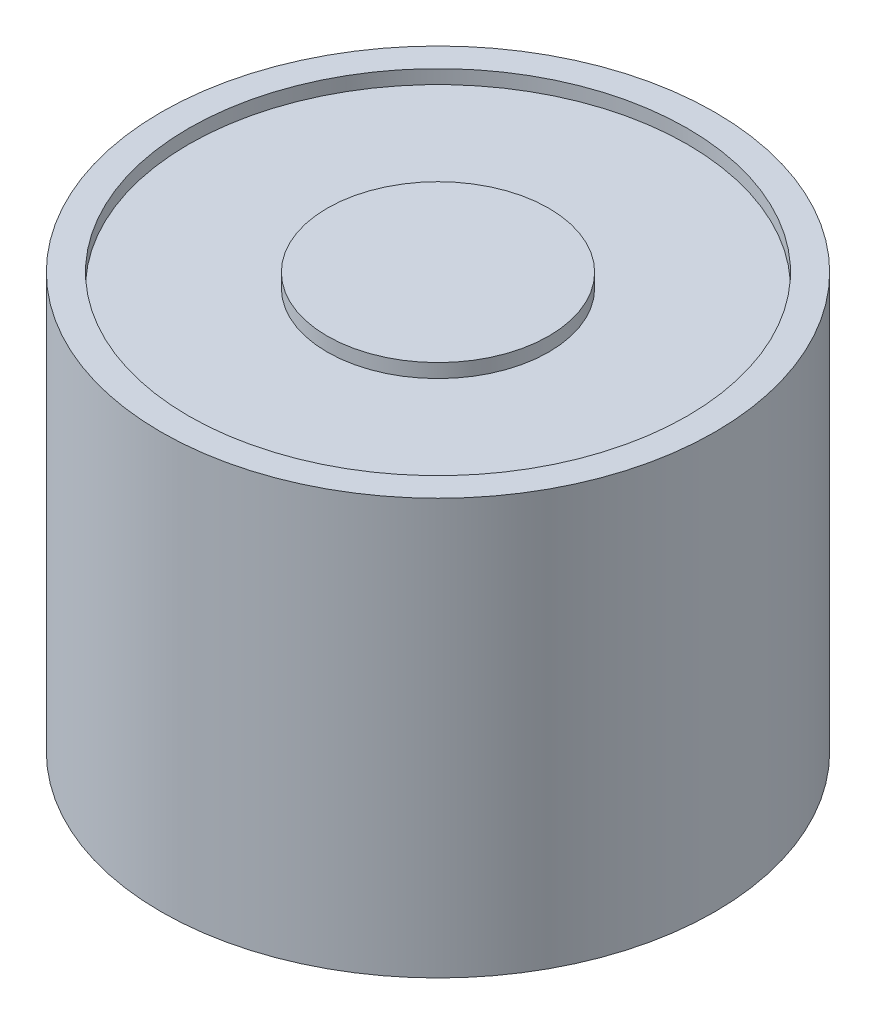
from build123d import *

# Parameters (mm, degrees)
SKETCH1_R                    = 10
BOSS_EXTRUDE1_DEPTH          = 15
SKETCH2_R                    = 9
SKETCH2_R_2                  = 4
CUT_EXTRUDE1_DEPTH           = 0.5
M2_5X0_45_TAPPED_HOLE1_D     = 2.05
M2_5X0_45_TAPPED_HOLE1_DEPTH = 6.35
M2_5X0_45_TAPPED_HOLE1_TIP   = 0.615882135


with BuildPart() as part:
    # Sketch1 → Boss-Extrude1 (new body)
    with BuildSketch(Plane(origin=(0, 0, 0), x_dir=(1, 0, 0), z_dir=(0, 1, 0))):
        with Locations(Location((0, 0, 0), (0, 0, 270))):
            Circle(SKETCH1_R)
    extrude(amount=BOSS_EXTRUDE1_DEPTH)

    # Sketch2 → Cut-Extrude1 (cut)
    with BuildSketch(Plane(origin=(0, 15, 0), x_dir=(1, 0, 0), z_dir=(0, 1, 0))):
        with Locations(Location((0, 0, 0), (0, 0, 270))):
            Circle(SKETCH2_R)
        with Locations(Location((0, 0, 0), (0, 0, 270))):
            Circle(SKETCH2_R_2, mode=Mode.SUBTRACT)
    extrude(amount=-CUT_EXTRUDE1_DEPTH, mode=Mode.SUBTRACT)

    # M2.5x0.45 Tapped Hole1
    with Locations(Plane(origin=(0, 0, 0), x_dir=(-1, 0, 0), z_dir=(0, -1, 0))):
        with Locations((0, 0)):
            Hole(M2_5X0_45_TAPPED_HOLE1_D / 2, depth=M2_5X0_45_TAPPED_HOLE1_DEPTH)
            with Locations((0, 0, -(M2_5X0_45_TAPPED_HOLE1_DEPTH + M2_5X0_45_TAPPED_HOLE1_TIP / 2))):  # 118° drill point
                Cone(0, M2_5X0_45_TAPPED_HOLE1_D / 2, M2_5X0_45_TAPPED_HOLE1_TIP, mode=Mode.SUBTRACT)


solid = part.part
